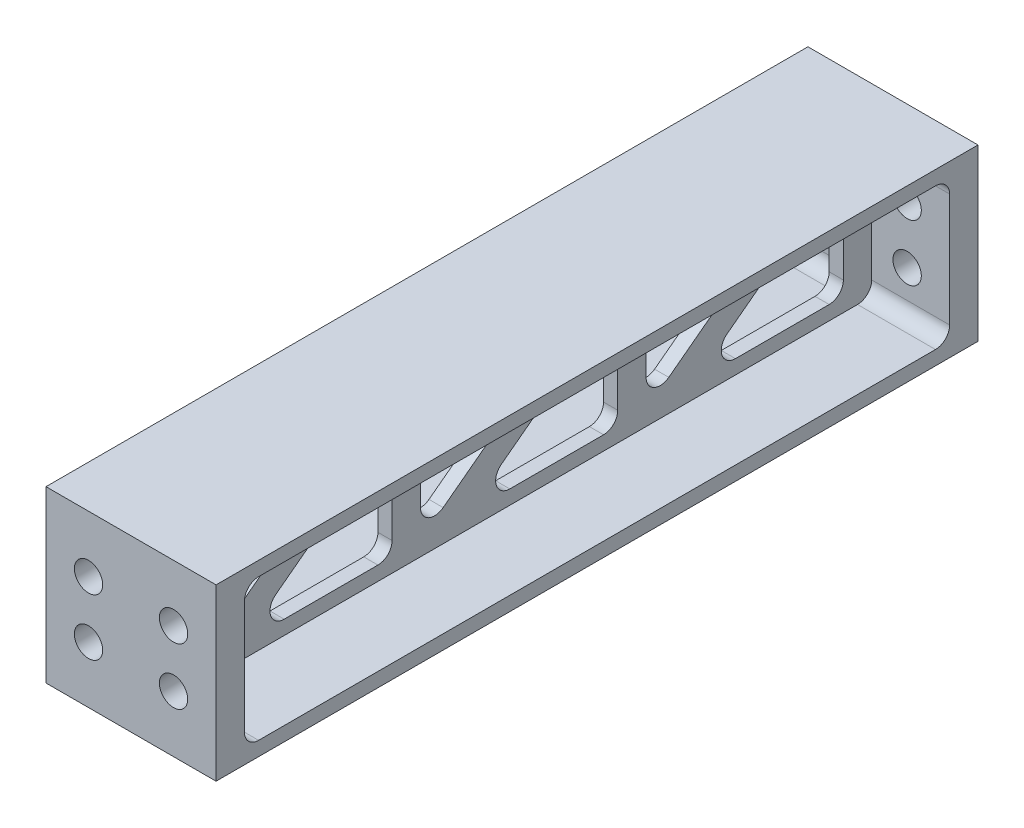
from build123d import *

# Parameters (mm, degrees)
SKETCH2_W                   = 38.1
SKETCH2_H                   = 38.1
BOSS_EXTRUDE1_DEPTH         = 170.686028715
SKETCH3_W                   = 157.986028715
SKETCH3_H                   = 31.75
CUT_EXTRUDE1_DEPTH          = 17.4625
FILLET1_R                   = 3.175
FILLET1_OF_MIRROR1_R        = 3.175
F_1_4_0_25_DIAMETER_HOLE1_D = 6.35
CUT_EXTRUDE2_REACH          = 178.1
FILLET3_R                   = 3.175


with BuildPart() as part:
    # Sketch2 → Boss-Extrude1 (new body)
    with BuildSketch(Plane.XY):
        with Locations((19.05, 19.05)):
            Rectangle(SKETCH2_W, SKETCH2_H)
    extrude(amount=BOSS_EXTRUDE1_DEPTH)

    # Sketch3 → Cut-Extrude1 (cut)
    with BuildSketch(Plane(origin=(38.1, 0, 0), x_dir=(0, 0, -1), z_dir=(1, 0, 0))):
        with Locations((-85.343014357, 19.05)):
            Rectangle(SKETCH3_W, SKETCH3_H)
    cut_extrude1 = extrude(amount=-CUT_EXTRUDE1_DEPTH, mode=Mode.SUBTRACT)

    # Fillet1
    fillet1_edges = [part.edges().sort_by_distance(p)[0] for p in [
        (29.36875, 3.175, 164.336028715),
        (29.36875, 34.925, 164.336028715),
        (29.36875, 34.925, 6.35),
        (29.36875, 3.175, 6.35),
    ]]
    fillet(fillet1_edges, radius=FILLET1_R)

    # Mirror1: Cut-Extrude1 across plane
    add(cut_extrude1.mirror(Plane(origin=(19.05, 0, 0), x_dir=(0, 0, 1), z_dir=(1, 0, 0))), mode=Mode.SUBTRACT)

    # Fillet1 of Mirror1
    fillet1_of_mirror1_edges = [part.edges().sort_by_distance(p)[0] for p in [
        (8.73125, 3.175, 164.336028715),
        (8.73125, 34.925, 164.336028715),
        (8.73125, 34.925, 6.35),
        (8.73125, 3.175, 6.35),
    ]]
    fillet(fillet1_of_mirror1_edges, radius=FILLET1_OF_MIRROR1_R)

    # 1/4 (0.25) Diameter Hole1 (through all)
    with Locations(Plane(origin=(0, 0, 0), x_dir=(-1, 0, 0), z_dir=(0, 0, -1))):
        with Locations((-9.525, 25.4), (-9.525, 12.7), (-28.575, 12.7), (-28.575, 25.4)):
            Hole(F_1_4_0_25_DIAMETER_HOLE1_D / 2)

    # Sketch7 → Cut-Extrude2 (cut, up to next)
    with BuildSketch(Plane.ZY.offset(-17.4625), mode=Mode.PRIVATE) as cut_extrude2_sk1:
        Polygon((12.7, 31.75), (12.7, 6.35), (46.354412352, 6.35), align=None)
    cut_extrude2_tool1 = extrude(cut_extrude2_sk1.sketch, amount=-CUT_EXTRUDE2_REACH, mode=Mode.PRIVATE) & part.part
    # Sketch7 → Cut-Extrude2 (cut, up to next)
    with BuildSketch(Plane.ZY.offset(-17.4625), mode=Mode.PRIVATE) as cut_extrude2_sk2:
        Polygon((23.240930553, 31.75), (56.895342905, 6.35), (56.895342905, 31.75), align=None)
    cut_extrude2_tool2 = extrude(cut_extrude2_sk2.sketch, amount=-CUT_EXTRUDE2_REACH, mode=Mode.PRIVATE) & part.part
    # Sketch7 → Cut-Extrude2 (cut, up to next)
    with BuildSketch(Plane.ZY.offset(-17.4625), mode=Mode.PRIVATE) as cut_extrude2_sk3:
        Polygon((63.245342905, 31.75), (63.245342905, 6.35), (96.899755257, 6.35), align=None)
    cut_extrude2_tool3 = extrude(cut_extrude2_sk3.sketch, amount=-CUT_EXTRUDE2_REACH, mode=Mode.PRIVATE) & part.part
    # Sketch7 → Cut-Extrude2 (cut, up to next)
    with BuildSketch(Plane.ZY.offset(-17.4625), mode=Mode.PRIVATE) as cut_extrude2_sk4:
        Polygon((73.786273458, 31.75), (107.44068581, 6.35), (107.44068581, 31.75), align=None)
    cut_extrude2_tool4 = extrude(cut_extrude2_sk4.sketch, amount=-CUT_EXTRUDE2_REACH, mode=Mode.PRIVATE) & part.part
    # Sketch7 → Cut-Extrude2 (cut, up to next)
    with BuildSketch(Plane.ZY.offset(-17.4625), mode=Mode.PRIVATE) as cut_extrude2_sk5:
        Polygon((113.79068581, 31.75), (113.79068581, 6.35), (147.445098162, 6.35), align=None)
    cut_extrude2_tool5 = extrude(cut_extrude2_sk5.sketch, amount=-CUT_EXTRUDE2_REACH, mode=Mode.PRIVATE) & part.part
    # Sketch7 → Cut-Extrude2 (cut, up to next)
    with BuildSketch(Plane.ZY.offset(-17.4625), mode=Mode.PRIVATE) as cut_extrude2_sk6:
        Polygon((124.331616363, 31.75), (157.986028715, 6.35), (157.986028715, 31.75), align=None)
    cut_extrude2_tool6 = extrude(cut_extrude2_sk6.sketch, amount=-CUT_EXTRUDE2_REACH, mode=Mode.PRIVATE) & part.part
    add(cut_extrude2_tool1.solids().sort_by_distance((17.4625, 14.816667, 23.918137))[0], mode=Mode.SUBTRACT)
    add(cut_extrude2_tool2.solids().sort_by_distance((17.4625, 23.283333, 45.677205))[0], mode=Mode.SUBTRACT)
    add(cut_extrude2_tool3.solids().sort_by_distance((17.4625, 14.816667, 74.46348))[0], mode=Mode.SUBTRACT)
    add(cut_extrude2_tool4.solids().sort_by_distance((17.4625, 23.283333, 96.222548))[0], mode=Mode.SUBTRACT)
    add(cut_extrude2_tool5.solids().sort_by_distance((17.4625, 14.816667, 125.008823))[0], mode=Mode.SUBTRACT)
    add(cut_extrude2_tool6.solids().sort_by_distance((17.4625, 23.283333, 146.767891))[0], mode=Mode.SUBTRACT)

    # Fillet3
    fillet3_edges = [part.edges().sort_by_distance(p)[0] for p in [
        (19.05, 31.75, 12.7),
        (19.05, 6.35, 46.354412352),
        (19.05, 6.35, 12.7),
        (19.05, 31.75, 23.240930553),
        (19.05, 31.75, 56.895342905),
        (19.05, 6.35, 56.895342905),
        (19.05, 31.75, 63.245342905),
        (19.05, 6.35, 96.899755257),
        (19.05, 6.35, 63.245342905),
        (19.05, 31.75, 113.79068581),
        (19.05, 6.35, 147.445098162),
        (19.05, 6.35, 113.79068581),
        (19.05, 31.75, 73.786273458),
        (19.05, 31.75, 107.44068581),
        (19.05, 6.35, 107.44068581),
        (19.05, 31.75, 124.331616363),
        (19.05, 31.75, 157.986028715),
        (19.05, 6.35, 157.986028715),
    ]]
    fillet(fillet3_edges, radius=FILLET3_R)


solid = part.part
